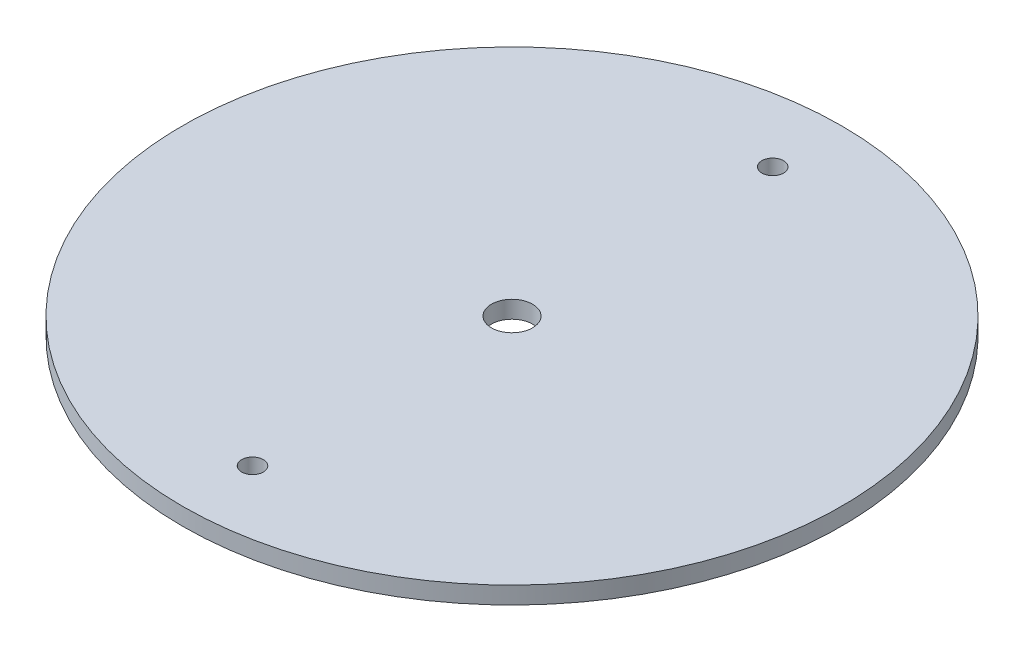
from build123d import *

# Parameters (mm, degrees)
SKETCH1_R           = 76.2
SKETCH1_R_2         = 4.75
BOSS_EXTRUDE1_DEPTH = 4
CUT_EXTRUDE1_REACH  = 109.837
SKETCH2_R           = 2.5


with BuildPart() as part:
    # Sketch1 → Boss-Extrude1 (new body)
    with BuildSketch(Plane(origin=(0, 0, 0), x_dir=(1, 0, 0), z_dir=(0, 1, 0))):
        with Locations(Location((0, 0, 0), (0, 0, 270))):
            Circle(SKETCH1_R)
        with Locations(Location((0, 0, 0), (0, 0, 270))):
            Circle(SKETCH1_R_2, mode=Mode.SUBTRACT)
    extrude(amount=BOSS_EXTRUDE1_DEPTH)

    # Sketch2 → Cut-Extrude1 (cut, up to next)
    with BuildSketch(Plane(origin=(0, 4, 0), x_dir=(1, 0, 0), z_dir=(0, 1, 0)), mode=Mode.PRIVATE) as cut_extrude1_sk1:
        with Locations(Location((0, -60, 0), (0, 0, 270))):
            Circle(SKETCH2_R)
    cut_extrude1_tool1 = extrude(cut_extrude1_sk1.sketch, amount=-CUT_EXTRUDE1_REACH, mode=Mode.PRIVATE) & part.part
    # Sketch2 → Cut-Extrude1 (cut, up to next)
    with BuildSketch(Plane(origin=(0, 4, 0), x_dir=(1, 0, 0), z_dir=(0, 1, 0)), mode=Mode.PRIVATE) as cut_extrude1_sk2:
        with Locations(Location((0.27778693, 59.99935695, 0), (0, 0, 270))):
            Circle(SKETCH2_R)
    cut_extrude1_tool2 = extrude(cut_extrude1_sk2.sketch, amount=-CUT_EXTRUDE1_REACH, mode=Mode.PRIVATE) & part.part
    add(cut_extrude1_tool1.solids().sort_by_distance((0, 4, 60))[0], mode=Mode.SUBTRACT)
    add(cut_extrude1_tool2.solids().sort_by_distance((0.277787, 4, -59.999357))[0], mode=Mode.SUBTRACT)


solid = part.part
